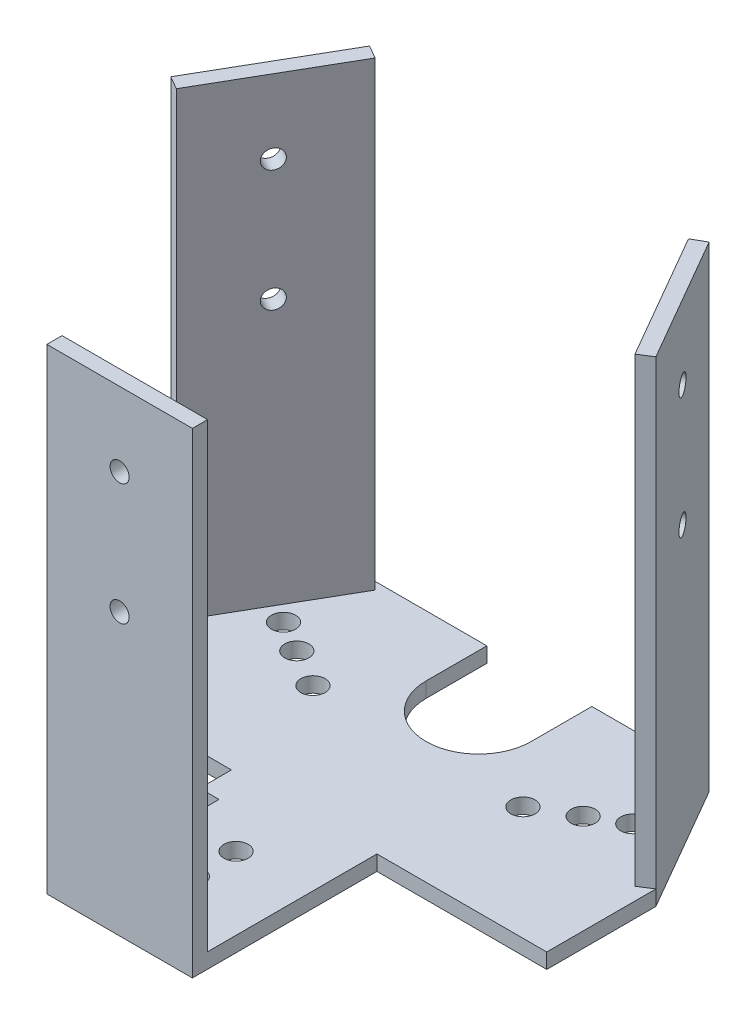
from build123d import *

# Parameters (mm, degrees)
SKETCH1_R           = 1.27
BOSS_EXTRUDE2_DEPTH = 1.5875
SKETCH2_W           = 15.24
SKETCH2_H           = 1.5875
BOSS_EXTRUDE3_DEPTH = 48.26
SKETCH3_R           = 1
CUT_EXTRUDE1_DEPTH  = 2.54
SKETCH4_R           = 1
CUT_EXTRUDE2_DEPTH  = 2.54
SKETCH5_R           = 1
CUT_EXTRUDE3_DEPTH  = 2.54
SKETCH6_W           = 2.032
SKETCH6_H           = 7.366
CUT_EXTRUDE4_DEPTH  = 2.54


with BuildPart() as part:
    # Sketch1 → Boss-Extrude2 (new body)
    with BuildSketch(Plane(origin=(0, 0, 0), x_dir=(1, 0, 0), z_dir=(0, 1, 0))):
        with BuildLine():
            Line((50.8, 0), (50.8, 11.43))
            Line((50.8, 11.43), (43.18, 24.628227154))
            Line((43.18, 24.628227154), (30.9, 24.628227154))
            Line((30.9, 24.628227154), (30.9, 18.264121265))
            ThreePointArc((30.9, 18.264121265), (25.4, 12.764121265), (19.9, 18.264121265))
            Line((19.9, 18.264121265), (19.9, 24.628227154))
            Line((19.9, 24.628227154), (7.62, 24.628227154))
            Line((7.62, 24.628227154), (0, 11.43))
            Line((0, 11.43), (0, 0))
            Line((0, 0), (17.78, 0))
            Line((17.78, 0), (17.78, -19.327878735))
            Line((17.78, -19.327878735), (33.02, -19.327878735))
            Line((33.02, -19.327878735), (33.02, 0))
            Line((33.02, 0), (50.8, 0))
        make_face()
        with Locations(Location((14.401477372, 11.914121265, 0), (0, 0, 270))):
            Circle(SKETCH1_R, mode=Mode.SUBTRACT)
        with Locations(Location((36.398522628, 11.914121265, 0), (0, 0, 270))):
            Circle(SKETCH1_R, mode=Mode.SUBTRACT)
        with Locations(Location((10.409113577, 14.219113577, 0), (0, 0, 270))):
            Circle(SKETCH1_R, mode=Mode.SUBTRACT)
        with Locations(Location((40.390886423, 14.219113577, 0), (0, 0, 270))):
            Circle(SKETCH1_R, mode=Mode.SUBTRACT)
        with Locations(Location((43.690443212, 16.124113577, 0), (0, 0, 270))):
            Circle(SKETCH1_R, mode=Mode.SUBTRACT)
        with Locations(Location((7.109556788, 16.124113577, 0), (0, 0, 270))):
            Circle(SKETCH1_R, mode=Mode.SUBTRACT)
        with Locations(Location((25.4, -7.135878735, 0), (0, 0, 270))):
            Circle(SKETCH1_R, mode=Mode.SUBTRACT)
        with Locations(Location((25.4, -15.517878735, 0), (0, 0, 270))):
            Circle(SKETCH1_R, mode=Mode.SUBTRACT)
        with Locations(Location((25.4, -11.707878735, 0), (0, 0, 270))):
            Circle(SKETCH1_R, mode=Mode.SUBTRACT)
    extrude(amount=BOSS_EXTRUDE2_DEPTH)

    # Sketch2 → Boss-Extrude3 (add)
    with BuildSketch(Plane(origin=(0, 1.5875, 0), x_dir=(1, 0, 0), z_dir=(0, 1, 0))):
        with Locations((25.4, -18.534128735)):
            Rectangle(SKETCH2_W, SKETCH2_H)
        Polygon((0, 11.43), (7.62, 24.628227154), (8.994815329, 23.834477154), (1.374815329, 10.63625), align=None)
        Polygon((50.8, 11.43), (43.18, 24.628227154), (41.806418442, 23.835189471), (49.460038325, 10.578730971), align=None)
    extrude(amount=BOSS_EXTRUDE3_DEPTH)

    # Sketch3 → Cut-Extrude1 (cut)
    with BuildSketch(Plane.XY.offset(19.327878735)):
        with Locations((25.4, 42.1025)):
            Circle(SKETCH3_R)
        with Locations((25.4, 29.4025)):
            Circle(SKETCH3_R)
    extrude(amount=-CUT_EXTRUDE1_DEPTH, mode=Mode.SUBTRACT)

    # Sketch4 → Cut-Extrude2 (cut)
    with BuildSketch(Plane(origin=(43.049335183, 0, -24.854545256), x_dir=(-0.5000000000000016, 0, -0.8660254037844378), z_dir=(0.8660254037844378, 0, -0.5000000000000016))):
        with Locations((-7.881329635, 42.1025)):
            Circle(SKETCH4_R)
        with Locations((-7.881329635, 29.4025)):
            Circle(SKETCH4_R)
    extrude(amount=-CUT_EXTRUDE2_DEPTH, mode=Mode.SUBTRACT)

    # Sketch5 → Cut-Extrude3 (cut)
    with BuildSketch(Plane(origin=(-4.949335183, 0, -2.8575), x_dir=(-0.5000000000000012, 0, 0.866025403784438), z_dir=(-0.8660254037844379, 0, -0.5000000000000011))):
        with Locations((-17.334430776, 42.104691674)):
            Circle(SKETCH5_R)
        with Locations((-17.334430776, 29.404691674)):
            Circle(SKETCH5_R)
    extrude(amount=-CUT_EXTRUDE3_DEPTH, mode=Mode.SUBTRACT)

    # Sketch6 → Cut-Extrude4 (cut)
    with BuildSketch(Plane(origin=(0, 0, 0), x_dir=(-1, 0, 0), z_dir=(0, -1, 0))):
        with Locations((-18.796, -7.008878735)):
            Rectangle(SKETCH6_W, SKETCH6_H)
    extrude(amount=-CUT_EXTRUDE4_DEPTH, mode=Mode.SUBTRACT)


solid = part.part
